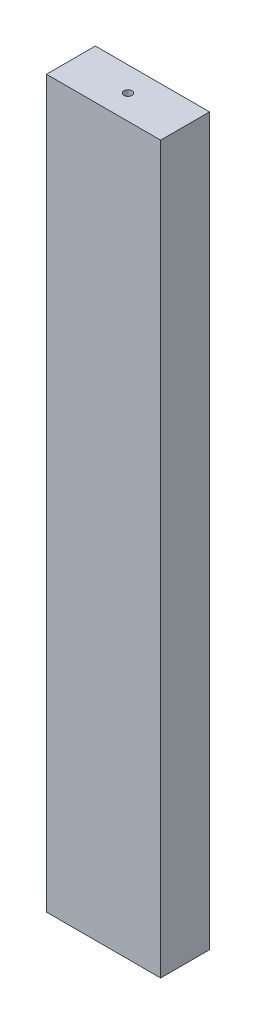
from build123d import *

# Parameters (mm, degrees)
SKETCH1_W           = 88.9
SKETCH1_H           = 38.1
BOSS_EXTRUDE1_DEPTH = 565.15
SKETCH2_R           = 3.175
CUT_EXTRUDE1_DEPTH  = 565.15


with BuildPart() as part:
    # Sketch1 → Boss-Extrude1 (new body)
    with BuildSketch(Plane(origin=(0, 0, 0), x_dir=(1, 0, 0), z_dir=(0, 1, 0))):
        with Locations((44.45, 19.05)):
            Rectangle(SKETCH1_W, SKETCH1_H)
    extrude(amount=BOSS_EXTRUDE1_DEPTH)

    # Sketch2 → Cut-Extrude1 (cut)
    with BuildSketch(Plane(origin=(0, 0, 0), x_dir=(-1, 0, 0), z_dir=(0, -1, 0))):
        with Locations(Location((-44.45, 19.05, 0), (0, 0, 90))):
            Circle(SKETCH2_R)
    extrude(amount=-CUT_EXTRUDE1_DEPTH, mode=Mode.SUBTRACT)


solid = part.part
